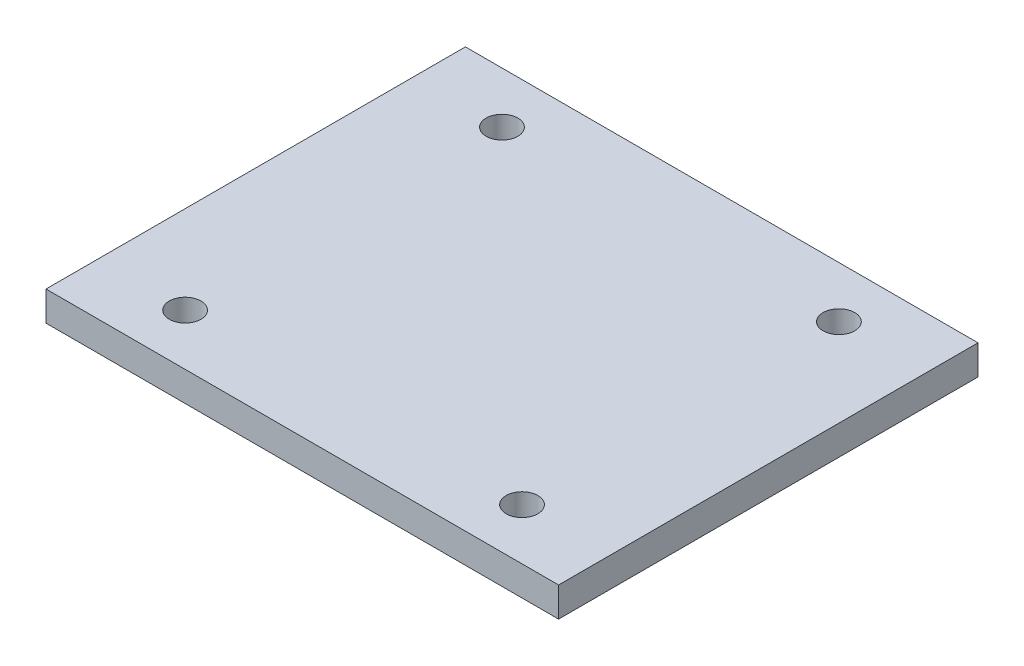
from build123d import *

# Parameters (mm, degrees)
SKETCH2_W            = 110
SKETCH2_H            = 90
BOSS_EXTRUDE1_DEPTH  = 6.35
SKETCH3_R            = 3.4
MOUNTING_HOLES_DEPTH = 143.268487375


with BuildPart() as part:
    # Sketch2 → Boss-Extrude1 (new body)
    with BuildSketch(Plane(origin=(0, 0, 0), x_dir=(1, 0, 0), z_dir=(0, 1, 0))):
        with Locations((55, 45)):
            Rectangle(SKETCH2_W, SKETCH2_H)
    extrude(amount=BOSS_EXTRUDE1_DEPTH)

    # Sketch3 → Mounting Holes (cut, through all)
    with BuildSketch(Plane(origin=(0, 6.35, 0), x_dir=(1, 0, 0), z_dir=(0, 1, 0))):
        with Locations(Location((18.85, 79, 0), (0, 0, 270))):
            Circle(SKETCH3_R)
        with Locations(Location((18.85, 11, 0), (0, 0, 90))):
            Circle(SKETCH3_R)
        with Locations(Location((91.15, 11, 0), (0, 0, 270))):
            Circle(SKETCH3_R)
        with Locations(Location((91.15, 79, 0), (0, 0, 90))):
            Circle(SKETCH3_R)
    extrude(amount=-MOUNTING_HOLES_DEPTH, mode=Mode.SUBTRACT)


solid = part.part
